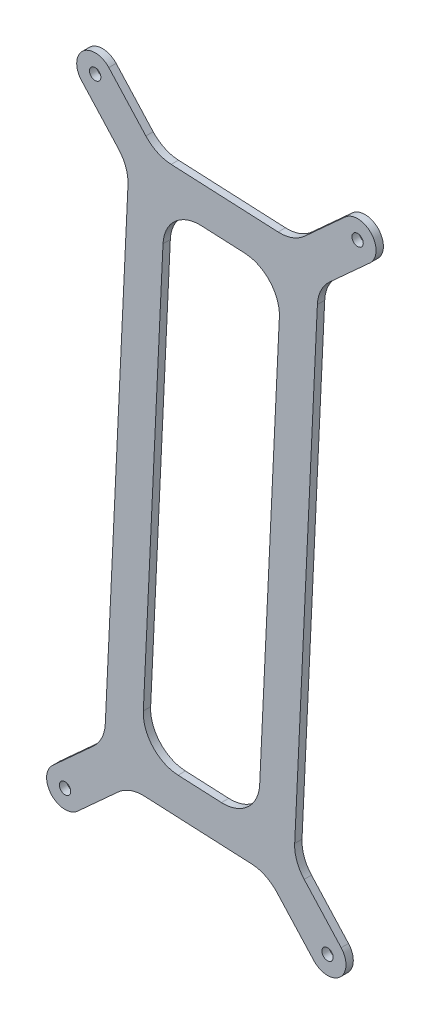
from build123d import *

# Parameters (mm, degrees)
SKETCH1_R           = 1.55
BOSS_EXTRUDE1_DEPTH = 2


with BuildPart() as part:
    # Sketch1 → Boss-Extrude1 (new body)
    with BuildSketch(Plane.XY):
        with BuildLine():
            ThreePointArc((25.385066163, -73.812983116), (23.373646331, -70.469589068), (22.794798226, -66.610958693))
            Line((22.794798226, -66.610958693), (29.003615503, 64.151484254))
            ThreePointArc((29.003615503, 64.151484254), (29.945463503, 67.93790946), (32.264619787, 71.075680584))
            Line((32.264619787, 71.075680584), (43.399330006, 81.200932599))
            ThreePointArc((43.399330006, 81.200932599), (43.738051861, 88.334674079), (36.604310381, 88.673395935))
            Line((36.604310381, 88.673395935), (25.469600163, 78.54814392))
            ThreePointArc((25.469600163, 78.54814392), (22.126206115, 76.536724088), (18.267575741, 75.957875984))
            Line((18.267575741, 75.957875984), (-10.988406497, 77.346998456))
            ThreePointArc((-10.988406497, 77.346998456), (-14.774831703, 78.288846456), (-17.912602827, 80.60800274))
            Line((-17.912602827, 80.60800274), (-28.037854841, 91.742712958))
            ThreePointArc((-28.037854841, 91.742712958), (-35.171596321, 92.081434814), (-35.510318177, 84.947693334))
            Line((-35.510318177, 84.947693334), (-25.385066163, 73.812983116))
            ThreePointArc((-25.385066163, 73.812983116), (-23.373646331, 70.469589068), (-22.794798226, 66.610958693))
            Line((-22.794798226, 66.610958693), (-29.003615503, -64.151484254))
            ThreePointArc((-29.003615503, -64.151484254), (-29.945463503, -67.93790946), (-32.264619787, -71.075680584))
            Line((-32.264619787, -71.075680584), (-43.399330005, -81.200932599))
            ThreePointArc((-43.399330005, -81.200932599), (-43.738051861, -88.334674079), (-36.604310381, -88.673395935))
            Line((-36.604310381, -88.673395935), (-25.469600163, -78.54814392))
            ThreePointArc((-25.469600163, -78.54814392), (-22.126206115, -76.536724088), (-18.26757574, -75.957875984))
            Line((-18.26757574, -75.957875984), (10.988406497, -77.346998456))
            ThreePointArc((10.988406497, -77.346998456), (14.774831703, -78.288846456), (17.912602827, -80.60800274))
            Line((17.912602827, -80.60800274), (28.037854841, -91.742712958))
            ThreePointArc((28.037854841, -91.742712958), (35.171596321, -92.081434814), (35.510318177, -84.947693334))
            Line((35.510318177, -84.947693334), (25.385066163, -73.812983116))
        make_face()
        with BuildLine():
            ThreePointArc((-9.087016293, -66.382517954), (-16.011212623, -63.121513669), (-18.601480559, -55.919489247))
            Line((-18.601480559, -55.919489247), (-13.219440196, 57.430399246))
            ThreePointArc((-13.219440196, 57.430399246), (-9.958435912, 64.354595576), (-2.756411489, 66.944863512))
            Line((-2.756411489, 66.944863512), (9.087016293, 66.382517954))
            ThreePointArc((9.087016293, 66.382517954), (16.011212623, 63.121513669), (18.601480559, 55.919489247))
            Line((18.601480559, 55.919489247), (13.219440196, -57.430399246))
            ThreePointArc((13.219440196, -57.430399246), (9.958435912, -64.354595576), (2.756411489, -66.944863512))
            Line((2.756411489, -66.944863512), (-9.087016293, -66.382517954))
        make_face(mode=Mode.SUBTRACT)
        with Locations((31.774086509, -88.345203146)):
            Circle(SKETCH1_R, mode=Mode.SUBTRACT)
        with Locations((-40.001820193, -84.937164267)):
            Circle(SKETCH1_R, mode=Mode.SUBTRACT)
        with Locations((40.001820193, 84.937164267)):
            Circle(SKETCH1_R, mode=Mode.SUBTRACT)
        with Locations((-31.774086509, 88.345203146)):
            Circle(SKETCH1_R, mode=Mode.SUBTRACT)
    extrude(amount=BOSS_EXTRUDE1_DEPTH)


solid = part.part
